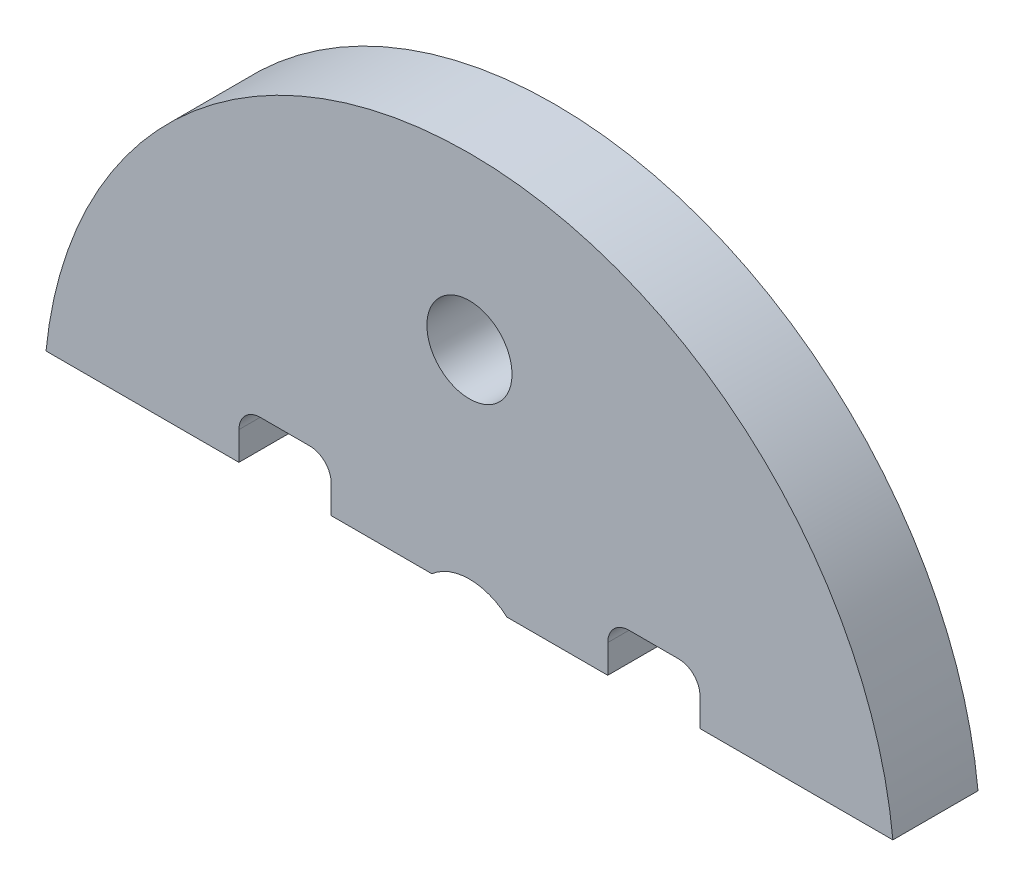
from build123d import *

# Parameters (mm, degrees)
MODEL_R                 = 1.5
SALIENTE_EXTRUIR1_DEPTH = 3


with BuildPart() as part:
    # Model → Saliente-Extruir1 (new body)
    with BuildSketch(Plane.XY):
        with BuildLine():
            Line((223.122807913, 245.202019993), (221.372807913, 245.202019993))
            ThreePointArc((221.372807913, 245.202019993), (220.842477828, 244.982350079), (220.622807913, 244.452019993))
            Line((220.622807913, 244.452019993), (220.622807913, 243.452019993))
            Line((220.622807913, 243.452019993), (217.070683569, 243.452019993))
            ThreePointArc((217.070683569, 243.452019993), (215.747807914, 243.952019993), (214.424932258, 243.452019993))
            Line((214.424932258, 243.452019993), (210.872807913, 243.452019993))
            Line((210.872807913, 243.452019993), (210.872807913, 244.452019993))
            ThreePointArc((210.872807913, 244.452019993), (210.653137999, 244.982350079), (210.122807913, 245.202019993))
            Line((210.122807913, 245.202019993), (208.372807913, 245.202019993))
            ThreePointArc((208.372807913, 245.202019993), (207.842477828, 244.982350079), (207.622807913, 244.452019993))
            Line((207.622807913, 244.452019993), (207.622807913, 243.452019993))
            Line((207.622807913, 243.452019993), (200.822996357, 243.452019993))
            ThreePointArc((200.822996357, 243.452019993), (215.747807914, 256.952019993), (230.67261947, 243.452019993))
            Line((230.67261947, 243.452019993), (223.872807913, 243.452019993))
            Line((223.872807913, 243.452019993), (223.872807913, 244.452019993))
            ThreePointArc((223.872807913, 244.452019993), (223.653137999, 244.982350079), (223.122807913, 245.202019993))
        make_face()
        with Locations((215.747807914, 250.952019993)):
            Circle(MODEL_R, mode=Mode.SUBTRACT)
    extrude(amount=SALIENTE_EXTRUIR1_DEPTH)


solid = part.part
